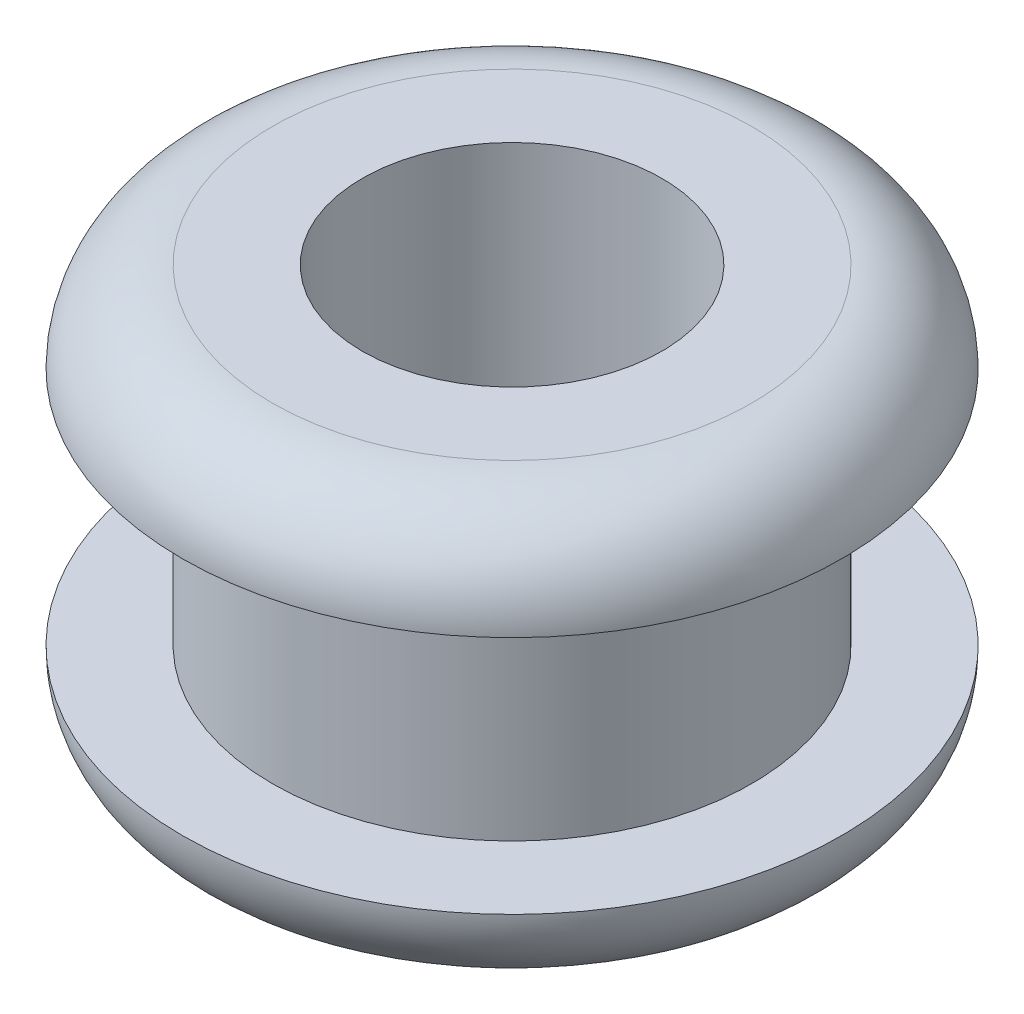
from build123d import *


with BuildPart() as part:
    # Sketch1 → Revolve1 (revolve)
    with BuildSketch(Plane.XY, mode=Mode.PRIVATE) as revolve1_sk:
        with BuildLine():
            Line((3.96875, 0), (6.35, 0))
            ThreePointArc((6.35, 0), (8.033798023, -0.697451977), (8.73125, -2.38125))
            Line((8.73125, -2.38125), (6.35, -2.38125))
            Line((6.35, -2.38125), (6.35, -8.73125))
            Line((6.35, -8.73125), (8.73125, -8.73125))
            ThreePointArc((8.73125, -8.73125), (8.033798023, -10.415048023), (6.35, -11.1125))
            Line((6.35, -11.1125), (3.96875, -11.1125))
            Line((3.96875, -11.1125), (3.96875, 0))
        make_face()
    revolve(revolve1_sk.sketch.rotate(Axis((0, 0, 0), (0, -1, 0)), 90), axis=Axis((0, 0, 0), (0, -1, 0)))


solid = part.part
